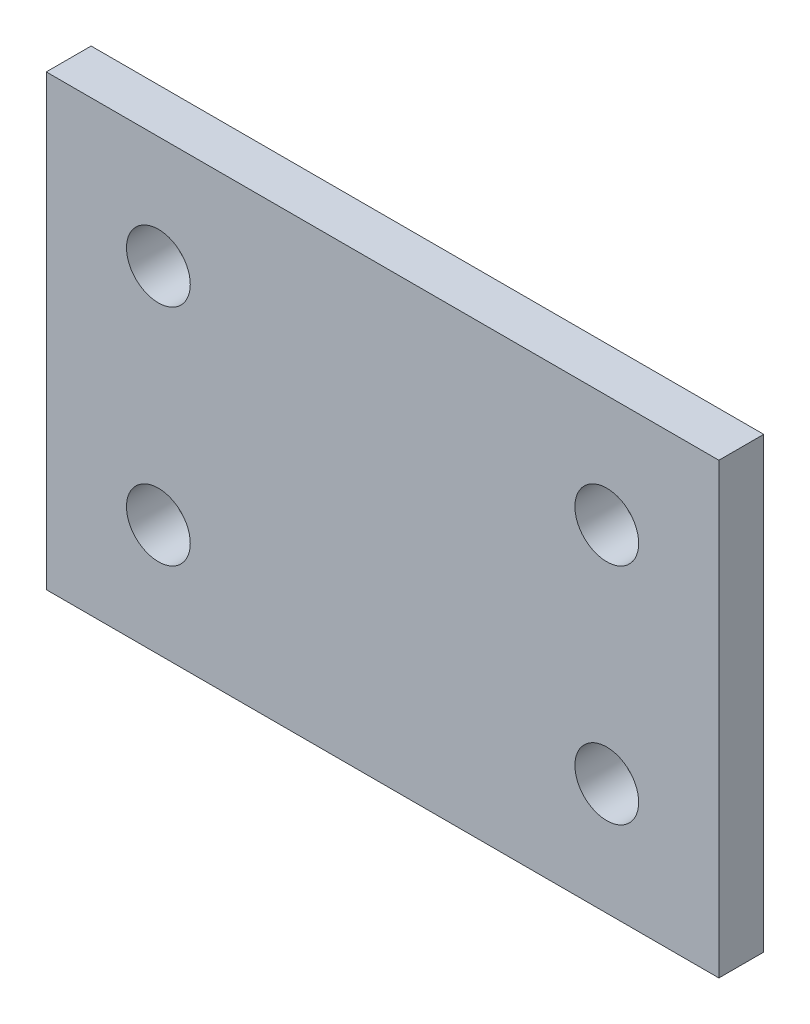
from build123d import *

# Parameters (mm, degrees)
SKETCH1_W           = 30
SKETCH1_H           = 20
BOSS_EXTRUDE1_DEPTH = 2
CUT_EXTRUDE1_REACH  = 20.138
SKETCH2_R           = 1.4224


with BuildPart() as part:
    # Sketch1 → Boss-Extrude1 (new body)
    with BuildSketch(Plane.XY):
        Rectangle(SKETCH1_W, SKETCH1_H)
    extrude(amount=BOSS_EXTRUDE1_DEPTH)

    # Sketch2 → Cut-Extrude1 (cut, up to next)
    with BuildSketch(Plane.XY.offset(2), mode=Mode.PRIVATE) as cut_extrude1_sk1:
        with Locations((10, 5)):
            Circle(SKETCH2_R)
    cut_extrude1_tool1 = extrude(cut_extrude1_sk1.sketch, amount=-CUT_EXTRUDE1_REACH, mode=Mode.PRIVATE) & part.part
    # Sketch2 → Cut-Extrude1 (cut, up to next)
    with BuildSketch(Plane.XY.offset(2), mode=Mode.PRIVATE) as cut_extrude1_sk2:
        with Locations((-10, 5)):
            Circle(SKETCH2_R)
    cut_extrude1_tool2 = extrude(cut_extrude1_sk2.sketch, amount=-CUT_EXTRUDE1_REACH, mode=Mode.PRIVATE) & part.part
    # Sketch2 → Cut-Extrude1 (cut, up to next)
    with BuildSketch(Plane.XY.offset(2), mode=Mode.PRIVATE) as cut_extrude1_sk3:
        with Locations((-10, -5)):
            Circle(SKETCH2_R)
    cut_extrude1_tool3 = extrude(cut_extrude1_sk3.sketch, amount=-CUT_EXTRUDE1_REACH, mode=Mode.PRIVATE) & part.part
    # Sketch2 → Cut-Extrude1 (cut, up to next)
    with BuildSketch(Plane.XY.offset(2), mode=Mode.PRIVATE) as cut_extrude1_sk4:
        with Locations((10, -5)):
            Circle(SKETCH2_R)
    cut_extrude1_tool4 = extrude(cut_extrude1_sk4.sketch, amount=-CUT_EXTRUDE1_REACH, mode=Mode.PRIVATE) & part.part
    add(cut_extrude1_tool1.solids().sort_by_distance((10, 5, 2))[0], mode=Mode.SUBTRACT)
    add(cut_extrude1_tool2.solids().sort_by_distance((-10, 5, 2))[0], mode=Mode.SUBTRACT)
    add(cut_extrude1_tool3.solids().sort_by_distance((-10, -5, 2))[0], mode=Mode.SUBTRACT)
    add(cut_extrude1_tool4.solids().sort_by_distance((10, -5, 2))[0], mode=Mode.SUBTRACT)


solid = part.part
